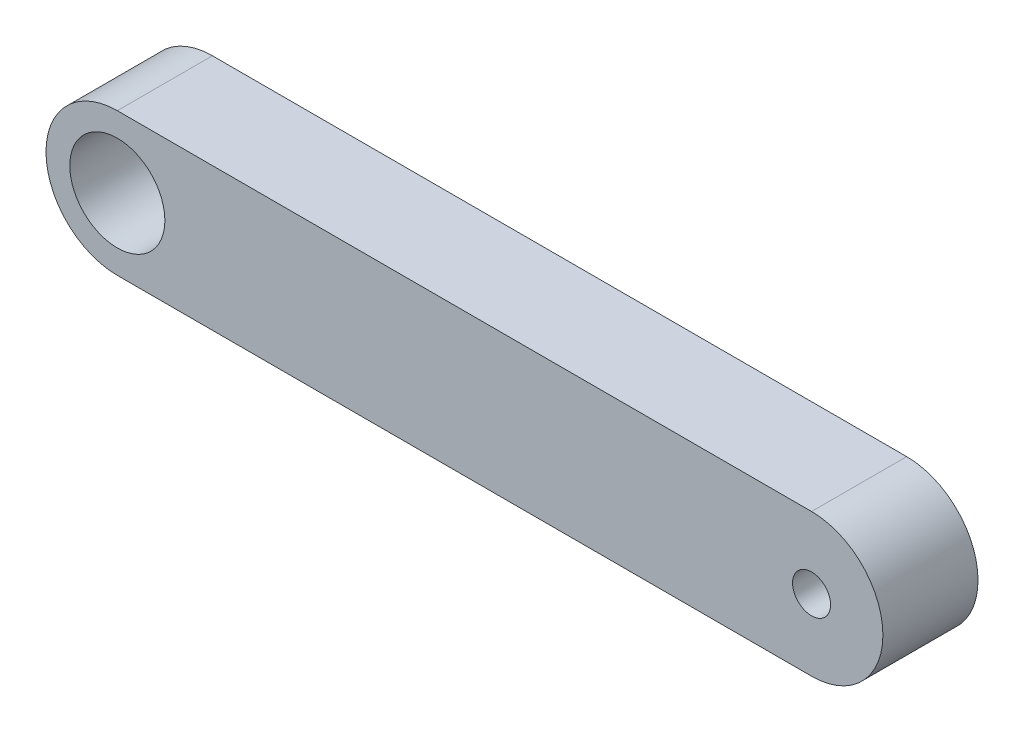
from build123d import *

# Parameters (mm, degrees)
BOSS_EXTRU_1_DEPTH      = 10
ESQUISSE2_R             = 5
ESQUISSE2_R_2           = 2
ENL_V_MAT_EXTRU_1_DEPTH = 82.464716289


with BuildPart() as part:
    # Esquisse1 → Boss.-Extru.1 (new body)
    with BuildSketch(Plane.XY):
        with BuildLine():
            Line((0, -7.5), (-73, -7.5))
            ThreePointArc((-73, -7.5), (-80.5, 0), (-73, 7.5))
            Line((-73, 7.5), (0, 7.5))
            ThreePointArc((0, 7.5), (7.5, 0), (0, -7.5))
        make_face()
    extrude(amount=BOSS_EXTRU_1_DEPTH)

    # Esquisse2 → Enlèv. mat.-Extru.1 (cut, through all)
    with BuildSketch(Plane.XY.offset(10)):
        with Locations((-73, 0)):
            Circle(ESQUISSE2_R)
        Circle(ESQUISSE2_R_2)
    extrude(amount=-ENL_V_MAT_EXTRU_1_DEPTH, mode=Mode.SUBTRACT)


solid = part.part
